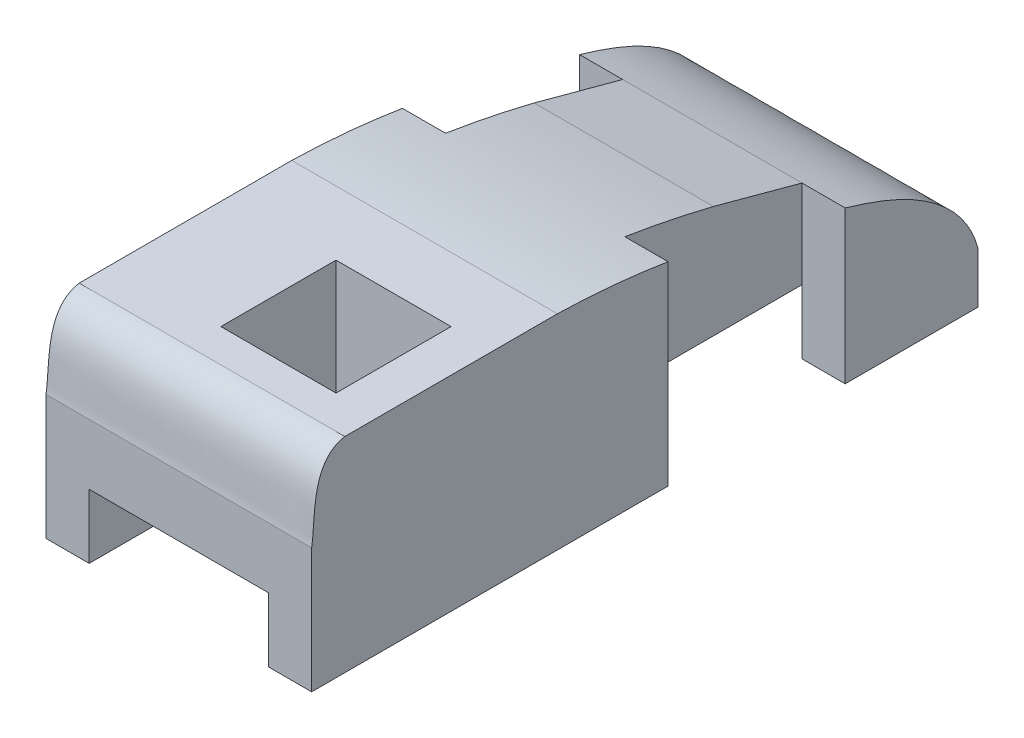
from build123d import *

# Parameters (mm, degrees)
SKETCH_1_W                = 100
SKETCH_1_H                = 185
EXTRUDE_1_DEPTH           = 100
SKETCH_2_W                = 100
SKETCH_2_H                = 3.8
CUT_EXTRUDE_1_DEPTH       = 155
CUT_EXTRUDE_2_DEPTH       = 155
SKETCH_4_W                = 25.5
SKETCH_4_H                = 25.5
CUT_EXTRUDE_3_DEPTH       = 79
SKETCH_6_W                = 89.706259743
SKETCH_6_H                = 10
SKETCH_6_W_2              = 10.293740257
CUT_EXTRUDE_4_DEPTH       = 146.107718609
CUT_EXTRUDE_5_DEPTH       = 169.985946161
CUT_EXTRUDE_5_DEPTH_BACK  = 169.985946161
SKETCH_7_W                = 20
SKETCH_7_H                = 3.8
EXTRUDE_4_DEPTH           = 160
SKETCH_10_W               = 16
SKETCH_10_H               = 1.8
CUT_EXTRUDE_6_DEPTH       = 155
SKETCH_13_W               = 20
SKETCH_13_H               = 175
CUT_EXTRUDE_7_DEPTH       = 143.515578096
SKETCH_14_W               = 175
SKETCH_14_H               = 50
CUT_EXTRUDE_8_DEPTH       = 149.849756466
SKETCH_15_W               = 60
SKETCH_15_H               = 10
CUT_EXTRUDE_9_DEPTH       = 108.660066877
SKETCH_16_W               = 60
SKETCH_16_H               = 14.5
CUT_EXTRUDE_10_DEPTH      = 108.660066877
CUT_EXTRUDE_11_DEPTH      = 111.381157812
CUT_EXTRUDE_21_DEPTH      = 162.400898529
CUT_EXTRUDE_21_DEPTH_BACK = 140.5
CUT_EXTRUDE_26_DEPTH      = 111.381157983
SKETCH_34_W               = 10
SKETCH_34_H               = 20
CUT_EXTRUDE_31_DEPTH      = 96.490523251
SKETCH_35_W               = 18.74373947
SKETCH_35_H               = 80.5
CUT_EXTRUDE_32_DEPTH      = 14
CUT_EXTRUDE_35_DEPTH      = 60
CUT_EXTRUDE_36_DEPTH      = 140.5
SKETCH_43_W               = 0.25
SKETCH_43_H               = 0.002112168
CUT_EXTRUDE_37_DEPTH      = 140.5
SKETCH_44_W               = 7.5
SKETCH_44_H               = 0.502112168
CUT_EXTRUDE_38_DEPTH      = 80.4999
SKETCH_45_W               = 9.75
SKETCH_45_H               = 20
SKETCH_45_W_2             = 9.75146362
CUT_EXTRUDE_39_DEPTH      = 96.490523251
SKETCH_46_W               = 0.24853638
SKETCH_46_H               = 20
SKETCH_46_W_2             = 0.25
EXTRUDE_5_DEPTH           = 31.697888
CUT_EXTRUDE_40_DEPTH      = 106.399537724
CUT_EXTRUDE_40_DEPTH_BACK = 106.399537724
SKETCH_54_W               = 25.5
SKETCH_54_H               = 0.5
CUT_EXTRUDE_41_DEPTH      = 29


with BuildPart() as part:
    # 草图1 → 凸台-拉伸1 (new body)
    with BuildSketch(Plane(origin=(0, 0, 0), x_dir=(1, 0, 0), z_dir=(0, 1, 0))):
        Rectangle(SKETCH_1_W, SKETCH_1_H)
    extrude(amount=EXTRUDE_1_DEPTH)

    # 草图2 → 切除-拉伸1 (cut)
    with BuildSketch(Plane.XY.offset(92.5)):
        with Locations((0, 1.9)):
            Rectangle(SKETCH_2_W, SKETCH_2_H)
    extrude(amount=-CUT_EXTRUDE_1_DEPTH, mode=Mode.SUBTRACT)

    # 草图3 → 切除-拉伸2 (cut)
    with BuildSketch(Plane.XY.offset(92.5)):
        with BuildLine():
            Line((-20, 3.8), (-3.51, 3.8))
            ThreePointArc((-3.51, 3.8), (-3.949598778, 3.901619975), (-4.3, 4.185860522))
            Line((-4.3, 4.185860522), (-9.371869735, 10.69267521))
            ThreePointArc((-9.371869735, 10.69267521), (-9.267749528, 11.143089764), (-8.9765156, 11.502112168))
            Line((-8.9765156, 11.502112168), (-4.5, 11.502112168))
            ThreePointArc((-4.5, 11.502112168), (-4.146446609, 11.648558777), (-4, 12.002112168))
            Line((-4, 12.002112168), (-4, 16.002112168))
            Line((-4, 16.002112168), (-20, 16.002112168))
            Line((-20, 16.002112168), (-20, 3.8))
        make_face()
        with BuildLine():
            ThreePointArc((4.3, 4.185860522), (3.949598778, 3.901619975), (3.51, 3.8))
            Line((3.51, 3.8), (20, 3.8))
            Line((20, 3.8), (20, 16.002112168))
            Line((20, 16.002112168), (4, 16.002112168))
            Line((4, 16.002112168), (4, 12.002112168))
            ThreePointArc((4, 12.002112168), (4.146446609, 11.648558777), (4.5, 11.502112168))
            Line((4.5, 11.502112168), (8.9765156, 11.502112168))
            ThreePointArc((8.9765156, 11.502112168), (9.426930154, 11.220838522), (9.371869735, 10.69267521))
            Line((9.371869735, 10.69267521), (4.3, 4.185860522))
        make_face()
    extrude(amount=-CUT_EXTRUDE_2_DEPTH, mode=Mode.SUBTRACT)

    # 草图4 → 切除-拉伸3 (cut)
    with BuildSketch(Plane(origin=(0, 100, 0), x_dir=(1, 0, 0), z_dir=(0, 1, 0))):
        with Locations((7.75, -50.25)):
            Rectangle(SKETCH_4_W, SKETCH_4_H)
    extrude(amount=-CUT_EXTRUDE_3_DEPTH, mode=Mode.SUBTRACT)

    # 草图6 → 切除-拉伸4 (cut, through all)
    with BuildSketch(Plane(origin=(0, 100, 0), x_dir=(1, 0, 0), z_dir=(0, 1, 0))):
        with Locations((5.146870128, 87.5)):
            Rectangle(SKETCH_6_W, SKETCH_6_H)
        with Locations((-44.853129872, 87.5)):
            Rectangle(SKETCH_6_W_2, SKETCH_6_H)
    extrude(amount=-CUT_EXTRUDE_4_DEPTH, mode=Mode.SUBTRACT)

    # 草图7 → 切除-拉伸5 (cut, two sides: drawn at the far end of the back side and taken through both)
    with BuildSketch(Plane.ZY.offset(50).offset(-CUT_EXTRUDE_5_DEPTH_BACK)):
        with Locations((-72.5, 1.9)):
            Rectangle(SKETCH_7_W, SKETCH_7_H)
    extrude(amount=CUT_EXTRUDE_5_DEPTH + CUT_EXTRUDE_5_DEPTH_BACK, mode=Mode.SUBTRACT)

    # 草图9 → 凸台-拉伸4 (add)
    with BuildSketch(Plane.XY.offset(92.5)):
        Polygon((-9.371869735, 10.69267521), (-9.371869735, 13.29267521), (-4, 13.29267521), (4, 13.29267521), (9.371869735, 13.29267521), (9.371869735, 10.69267521), align=None)
    extrude(amount=-EXTRUDE_4_DEPTH)

    # 草图10 → 切除-拉伸6 (cut)
    with BuildSketch(Plane.XY.offset(92.5)):
        with Locations((-12, 16.902112168)):
            Rectangle(SKETCH_10_W, SKETCH_10_H)
        Polygon((4, 16.002112168), (4, 17.802112168), (19.99853638, 17.802112168), (20, 16.002112168), align=None)
    extrude(amount=-CUT_EXTRUDE_6_DEPTH, mode=Mode.SUBTRACT)

    # 草图13 → 切除-拉伸7 (cut, through all)
    with BuildSketch(Plane.XZ.offset(-3.8)):
        with Locations((-40, 5)):
            Rectangle(SKETCH_13_W, SKETCH_13_H)
        with Locations((40, 5)):
            Rectangle(SKETCH_13_W, SKETCH_13_H)
    extrude(amount=-CUT_EXTRUDE_7_DEPTH, mode=Mode.SUBTRACT)

    # 草图14 → 切除-拉伸8 (cut, through all)
    with BuildSketch(Plane(origin=(30, 0, 0), x_dir=(0, 0, -1), z_dir=(1, 0, 0))):
        with Locations((-5, 75)):
            Rectangle(SKETCH_14_W, SKETCH_14_H)
    extrude(amount=-CUT_EXTRUDE_8_DEPTH, mode=Mode.SUBTRACT)

    # 草图15 → 切除-拉伸9 (cut, through all)
    with BuildSketch(Plane.XZ.offset(-3.8)):
        with Locations((0, -77.5)):
            Rectangle(SKETCH_15_W, SKETCH_15_H)
    extrude(amount=-CUT_EXTRUDE_9_DEPTH, mode=Mode.SUBTRACT)

    # 草图16 → 切除-拉伸10 (cut, through all)
    with BuildSketch(Plane(origin=(0, 50, 0), x_dir=(1, 0, 0), z_dir=(0, 1, 0))):
        with Locations((0, -85.25)):
            Rectangle(SKETCH_16_W, SKETCH_16_H)
    extrude(amount=-CUT_EXTRUDE_10_DEPTH, mode=Mode.SUBTRACT)

    # 草图17 → 切除-拉伸11 (cut, through all)
    with BuildSketch(Plane(origin=(30, 0, 0), x_dir=(0, 0, -1), z_dir=(1, 0, 0))):
        with BuildLine():
            Line((72.5, 50), (-22.5, 50))
            add(Edge.make_bspline(
                [(-22.5, 50), (-9.330669895, 49.706144403), (11.085821801, 46.827148239), (38.239751221, 39.498978447), (59.688603115, 33.272875951), (70.679662454, 22.295526596), (72.5, 15.311284203)],
                knots=[0, 0, 0, 0, 0.374533404, 0.581855131, 0.802431491, 1, 1, 1, 1], degree=3))
            Line((72.5, 15.311284203), (72.5, 50))
        make_face()
    extrude(amount=-CUT_EXTRUDE_11_DEPTH, mode=Mode.SUBTRACT)

    # 草图24 → 切除-拉伸21 (cut, two sides: drawn at the far end of the back side and taken through both)
    with BuildSketch(Plane.XY.offset(78).offset(-CUT_EXTRUDE_21_DEPTH_BACK)):
        with BuildLine():
            Line((9.371869735, 11.309008937), (9.371869735, 10.69267521))
            ThreePointArc((9.371869735, 10.69267521), (9.477785695, 11.000842073), (9.371869735, 11.309008937))
        make_face()
    extrude(amount=CUT_EXTRUDE_21_DEPTH + CUT_EXTRUDE_21_DEPTH_BACK, mode=Mode.SUBTRACT)

    # 草图28 → 切除-拉伸26 (cut, through all)
    with BuildSketch(Plane(origin=(30, 0, 0), x_dir=(0, 0, -1), z_dir=(1, 0, 0))):
        with BuildLine():
            Line((-70.5, 50), (-78, 50))
            Line((-78, 50), (-78, 31.982866201))
            add(Edge.make_bspline(
                [(-70.5, 50), (-78.410932033, 48.656434308), (-77.0737544, 36.843285786), (-78, 31.982866201)],
                knots=[0, 0, 0, 0, 1, 1, 1, 1], degree=3))
        make_face()
    extrude(amount=-CUT_EXTRUDE_26_DEPTH, mode=Mode.SUBTRACT)

    # 草图34 → 切除-拉伸31 (cut, through all)
    with BuildSketch(Plane.XZ.offset(-3.8)):
        with Locations((-25, -32.5)):
            Rectangle(SKETCH_34_W, SKETCH_34_H)
        with Locations((25, -32.5)):
            Rectangle(SKETCH_34_W, SKETCH_34_H)
    extrude(amount=-CUT_EXTRUDE_31_DEPTH, mode=Mode.SUBTRACT)

    # 草图35 → 切除-拉伸32 (cut)
    with BuildSketch(Plane.XZ.offset(-3.8)):
        with Locations((0, 37.75)):
            Rectangle(SKETCH_35_W, SKETCH_35_H)
    extrude(amount=-CUT_EXTRUDE_32_DEPTH, mode=Mode.SUBTRACT)

    # 草图40 → 切除-拉伸35 (cut)
    with BuildSketch(Plane.XY.offset(-2.5)):
        Polygon((4, 13.29267521), (4, 17.8), (3.75, 17.8), (3.75, 12.79267521), (9.371869735, 12.79267521), (9.371869735, 13.29267521), align=None)
        Polygon((-3.75, 17.8), (-4, 17.8), (-4, 13.29267521), (-9.371869735, 13.29267521), (-9.371869735, 12.79267521), (-3.75, 12.79267521), align=None)
    extrude(amount=-CUT_EXTRUDE_35_DEPTH, mode=Mode.SUBTRACT)

    # 草图41 → 切除-拉伸36 (cut)
    with BuildSketch(Plane.XY.offset(78)):
        Polygon((-3.75, 18.302112168), (-20.25, 18.302112168), (-20.25, 3.8), (-20, 3.8), (-20, 17.802112168), (-3.75, 17.802112168), align=None)
        Polygon((3.75, 18.302112168), (3.75, 17.802112168), (19.99853638, 17.802112168), (19.99853638, 3.8), (20.24853638, 3.8), (20.24853638, 18.302112168), align=None)
    extrude(amount=-CUT_EXTRUDE_36_DEPTH, mode=Mode.SUBTRACT)

    # 草图43 → 切除-拉伸37 (cut)
    with BuildSketch(Plane.XY.offset(78)):
        with Locations((-3.875, 17.801056084)):
            Rectangle(SKETCH_43_W, SKETCH_43_H)
        with Locations((3.875, 17.801056084)):
            Rectangle(SKETCH_43_W, SKETCH_43_H)
    extrude(amount=-CUT_EXTRUDE_37_DEPTH, mode=Mode.SUBTRACT)

    # 草图44 → 切除-拉伸38 (cut)
    with BuildSketch(Plane.XY.offset(78)):
        with Locations((0, 18.051056084)):
            Rectangle(SKETCH_44_W, SKETCH_44_H)
    extrude(amount=-CUT_EXTRUDE_38_DEPTH, mode=Mode.SUBTRACT)

    # 草图45 → 切除-拉伸39 (cut, through all)
    with BuildSketch(Plane.XZ.offset(-3.8)):
        with Locations((-25.125, -12.5)):
            Rectangle(SKETCH_45_W, SKETCH_45_H)
        with Locations((25.12426819, -12.5)):
            Rectangle(SKETCH_45_W_2, SKETCH_45_H)
    extrude(amount=-CUT_EXTRUDE_39_DEPTH, mode=Mode.SUBTRACT)

    # 草图46 → 凸台-拉伸5 (add, through all)
    with BuildSketch(Plane.XZ.offset(-18.302112168)):
        with Locations((20.12426819, -32.5)):
            Rectangle(SKETCH_46_W, SKETCH_46_H)
        with Locations((-20.125, -32.5)):
            Rectangle(SKETCH_46_W_2, SKETCH_46_H)
    extrude(amount=-EXTRUDE_5_DEPTH)

    # 草图47 → 切除-拉伸40 (cut, two sides: drawn at the far end of the back side and taken through both)
    with BuildSketch(Plane.ZY.offset(20.25).offset(-CUT_EXTRUDE_40_DEPTH_BACK)):
        Polygon((-42.5, 38.203961841), (-22.5, 43.618048783), (-22.5, 50), (-42.5, 50), align=None)
    extrude(amount=CUT_EXTRUDE_40_DEPTH + CUT_EXTRUDE_40_DEPTH_BACK, mode=Mode.SUBTRACT)

    # 草图54 → 切除-拉伸41 (cut)
    with BuildSketch(Plane(origin=(0, 50, 0), x_dir=(1, 0, 0), z_dir=(0, 1, 0))):
        with Locations((7.75, -37.25)):
            Rectangle(SKETCH_54_W, SKETCH_54_H)
        Polygon((-5, -63), (-5, -37.5), (-5, -37), (-5.5, -37), (-5.5, -63), align=None)
    extrude(amount=-CUT_EXTRUDE_41_DEPTH, mode=Mode.SUBTRACT)


solid = part.part
